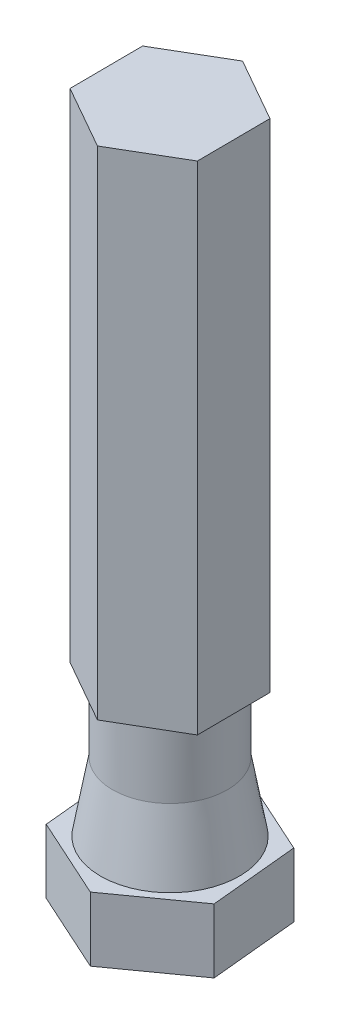
from build123d import *

# Parameters (mm, degrees)
BOSS_EXTRUDE1_DEPTH = 7.1
SKETCH2_R           = 7.682494309
SKETCH2_R_2         = 1.75
BOSS_EXTRUDE3_DEPTH = 7.6
BOSS_EXTRUDE3_DRAFT = 10
SKETCH6_R           = 6.342409255
BOSS_EXTRUDE6_DEPTH = 7.6
BOSS_EXTRUDE7_DEPTH = 55


with BuildPart() as part:
    # Sketch1 → Boss-Extrude1 (new body)
    with BuildSketch(Plane(origin=(0, 0, 0), x_dir=(1, 0, 0), z_dir=(0, 1, 0))):
        Polygon((-17.299814282, 3.228425178), (-26.236838815, 7.285878299), (-34.219208559, 1.57491458), (-33.26455377, -8.193502261), (-24.327529237, -12.250955382), (-16.345159493, -6.539991662), align=None)
        Polygon((-19.630317243, -5.048513876), (-20.234050809, 1.129134004), (-25.885917592, 3.695109339), (-30.934050809, 0.083436793), (-30.330317243, -6.094211087), (-24.67845046, -8.660186422), align=None, mode=Mode.SUBTRACT)
    extrude(amount=BOSS_EXTRUDE1_DEPTH)


with BuildPart() as boss_extrude3_tool:
    # Sketch2 → Boss-Extrude3 (with draft: the straight prism first)
    with BuildSketch(Plane(origin=(0, 7.1, 0), x_dir=(1, 0, 0), z_dir=(0, 1, 0))):
        with Locations((-25.282184026, -2.482538541)):
            Circle(SKETCH2_R)
        with Locations((-25.282184026, -2.482538541)):
            Circle(SKETCH2_R_2, mode=Mode.SUBTRACT)
    extrude(amount=BOSS_EXTRUDE3_DEPTH)
    # Boss-Extrude3: the draft: its side faces are tilted about the plane it starts from
    boss_extrude3_sides = [boss_extrude3_tool.faces().sort_by_distance(p)[0] for p in [
        (-32.964678335, 10.9, 2.482538541),
        (-27.032184026, 10.9, 2.482538541),
    ]]
    draft(boss_extrude3_sides, Plane(origin=(0, 7.1, 0), x_dir=(1, 0, 0), z_dir=(0, 1, 0)), BOSS_EXTRUDE3_DRAFT)


with BuildPart() as part_1:
    add(part.part)

    # Boss-Extrude3: add boss_extrude3_tool
    add(boss_extrude3_tool.part)

    # Sketch6 → Boss-Extrude6 (add)
    with BuildSketch(Plane(origin=(0, 14.7, 0), x_dir=(1, 0, 0), z_dir=(0, 1, 0))):
        with Locations(Location((-25.282184026, -2.482538541, 0), (0, 0, 90))):
            Circle(SKETCH6_R)
    extrude(amount=BOSS_EXTRUDE6_DEPTH)

    # Sketch7 → Boss-Extrude7 (add)
    with BuildSketch(Plane(origin=(0, 22.3, 0), x_dir=(1, 0, 0), z_dir=(0, 1, 0))):
        Polygon((-18.255240013, -6.477322026), (-18.309128039, 1.605581742), (-25.336072052, 5.600365227), (-32.309128039, 1.512244944), (-32.255240013, -6.570658825), (-25.228296, -10.56544231), align=None)
    extrude(amount=BOSS_EXTRUDE7_DEPTH)


solid = part_1.part
